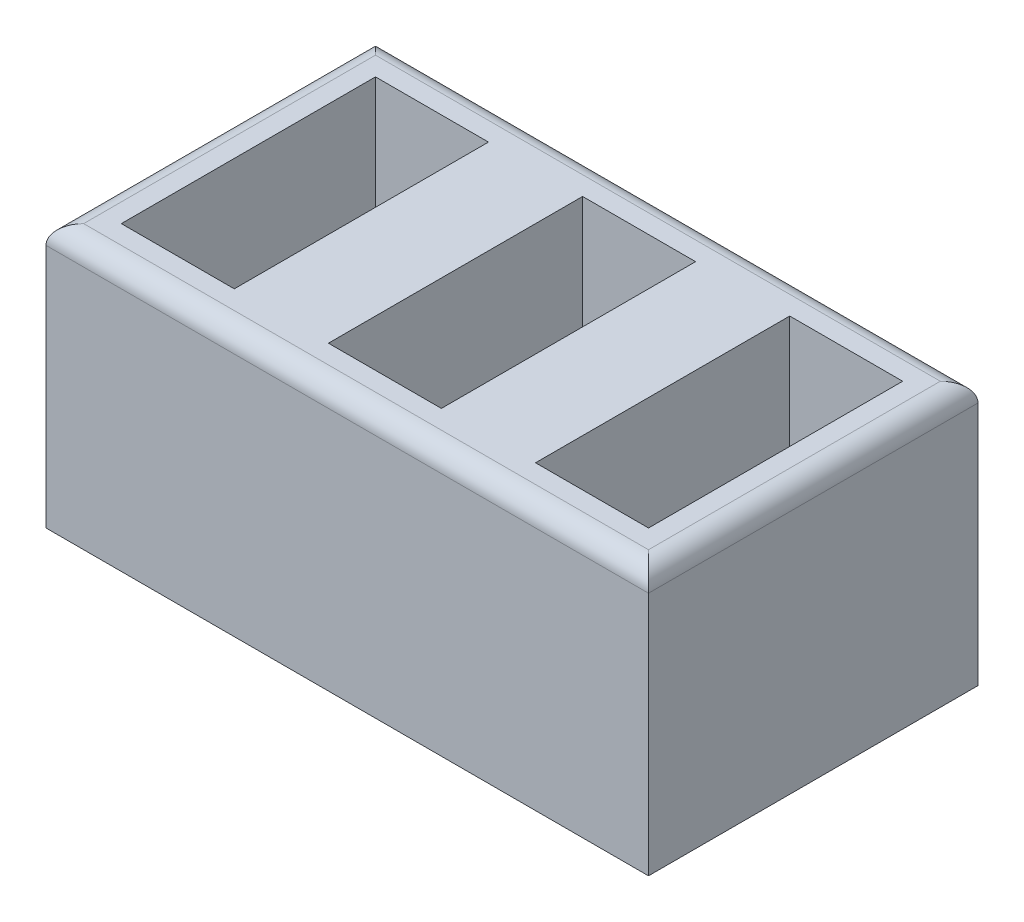
from build123d import *

# Parameters (mm, degrees)
SKETCH1_W           = 32
SKETCH1_H           = 17.5
BOSS_EXTRUDE1_DEPTH = 14
SKETCH2_W           = 6
SKETCH2_H           = 13.5
CUT_EXTRUDE1_DEPTH  = 13.6
LPATTERN1_COUNT     = 3
LPATTERN1_PITCH     = 11
FILLET1_R           = 1


with BuildPart() as part:
    # Sketch1 → Boss-Extrude1 (new body)
    with BuildSketch(Plane(origin=(0, 0, 0), x_dir=(1, 0, 0), z_dir=(0, 1, 0))):
        with Locations((16, 8.75)):
            Rectangle(SKETCH1_W, SKETCH1_H)
    extrude(amount=BOSS_EXTRUDE1_DEPTH)

    # Sketch2 → Cut-Extrude1 (cut)
    with BuildSketch(Plane(origin=(0, 14, 0), x_dir=(1, 0, 0), z_dir=(0, 1, 0))):
        with Locations((5, 8.75)):
            Rectangle(SKETCH2_W, SKETCH2_H)
    cut_extrude1 = extrude(amount=-CUT_EXTRUDE1_DEPTH, mode=Mode.SUBTRACT)

    # LPattern1: Cut-Extrude1 ×3
    with Locations(*[(i * LPATTERN1_PITCH, 0, 0) for i in range(1, LPATTERN1_COUNT)]):
        add(cut_extrude1, mode=Mode.SUBTRACT)

    # Fillet1
    fillet1_edges = [part.edges().sort_by_distance(p)[0] for p in [
        (32, 14, -8.75),
        (16, 14, -17.5),
        (0, 14, -8.75),
        (16, 14, 0),
    ]]
    fillet(fillet1_edges, radius=FILLET1_R)


solid = part.part
